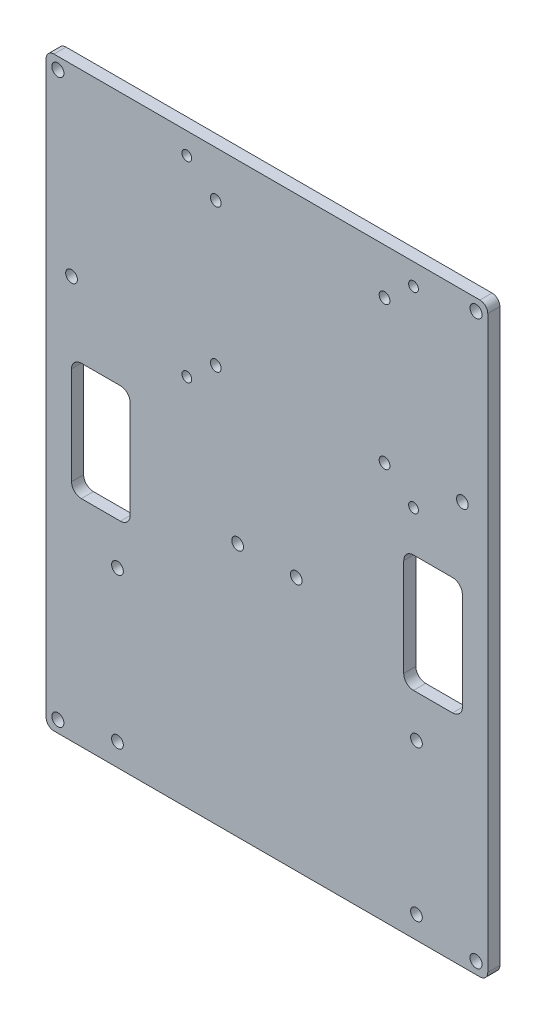
from build123d import *

# Parameters (mm, degrees)
SKETCH1_W           = 113
SKETCH1_H           = 150
BOSS_EXTRUDE1_DEPTH = 3.1
SKETCH9_R           = 1.55
CUT_EXTRUDE7_DEPTH  = 94.9513704
SKETCH10_R          = 1.25
CUT_EXTRUDE8_DEPTH  = 94.9513704
SKETCH12_R          = 1.5
CUT_EXTRUDE9_DEPTH  = 94.9513704
SKETCH13_R          = 1.5
CUT_EXTRUDE10_DEPTH = 94.9513704
SKETCH14_W          = 15
SKETCH14_H          = 30
CUT_EXTRUDE11_DEPTH = 94.9513704
SKETCH16_R          = 1.375
CUT_EXTRUDE12_DEPTH = 94.9513704
SKETCH18_R          = 1.5
CUT_EXTRUDE13_DEPTH = 94.9513704
FILLET1_R           = 2
FILLET2_R           = 2.5


with BuildPart() as part:
    # Sketch1 → Boss-Extrude1 (new body)
    with BuildSketch(Plane.XY):
        Rectangle(SKETCH1_W, SKETCH1_H)
    extrude(amount=BOSS_EXTRUDE1_DEPTH)

    # Sketch9 → Cut-Extrude7 (cut, through all)
    with BuildSketch(Plane.XY.offset(3.1)):
        with Locations((-53.5, 72)):
            Circle(SKETCH9_R)
        with Locations((53.5, 72)):
            Circle(SKETCH9_R)
        with Locations((53.5, -72)):
            Circle(SKETCH9_R)
        with Locations((-53.5, -72)):
            Circle(SKETCH9_R)
    extrude(amount=-CUT_EXTRUDE7_DEPTH, mode=Mode.SUBTRACT)

    # Sketch10 → Cut-Extrude8 (cut, through all)
    with BuildSketch(Plane.XY.offset(3.1)):
        with BuildLine():
            ThreePointArc((37.5, 21.75), (36.616116524, 21.383883476), (36.25, 20.5))
            Line((36.25, 20.5), (37.5, 20.5))
            Line((37.5, 20.5), (37.5, 21.75))
        make_face()
        with BuildLine():
            Line((37.5, 20.5), (36.25, 20.5))
            ThreePointArc((36.25, 20.5), (37.5, 19.25), (38.75, 20.5))
            ThreePointArc((38.75, 20.5), (38.383883476, 21.383883476), (37.5, 21.75))
            Line((37.5, 21.75), (37.5, 20.5))
        make_face()
        with Locations((-20.5, 69.5)):
            Circle(SKETCH10_R)
        with Locations((37.5, 69.5)):
            Circle(SKETCH10_R)
        with Locations((-20.5, 20.5)):
            Circle(SKETCH10_R)
    extrude(amount=-CUT_EXTRUDE8_DEPTH, mode=Mode.SUBTRACT)

    # Sketch12 → Cut-Extrude9 (cut, through all)
    with BuildSketch(Plane.XY.offset(3.1)):
        with Locations((-38.25, -30.75)):
            Circle(SKETCH12_R)
        with Locations((-38.25, -69.25)):
            Circle(SKETCH12_R)
        with Locations((38.25, -69.25)):
            Circle(SKETCH12_R)
        with Locations((38.25, -30.75)):
            Circle(SKETCH12_R)
    extrude(amount=-CUT_EXTRUDE9_DEPTH, mode=Mode.SUBTRACT)

    # Sketch13 → Cut-Extrude10 (cut, through all)
    with BuildSketch(Plane.XY.offset(3.1)):
        with Locations((-7.5, -10)):
            Circle(SKETCH13_R)
        with Locations((7.5, -10)):
            Circle(SKETCH13_R)
    extrude(amount=-CUT_EXTRUDE10_DEPTH, mode=Mode.SUBTRACT)

    # Sketch14 → Cut-Extrude11 (cut, through all)
    with BuildSketch(Plane.XY.offset(3.1)):
        with Locations((42.5, -5)):
            Rectangle(SKETCH14_W, SKETCH14_H)
        with Locations((-42.5, -5)):
            Rectangle(SKETCH14_W, SKETCH14_H)
    extrude(amount=-CUT_EXTRUDE11_DEPTH, mode=Mode.SUBTRACT)

    # Sketch16 → Cut-Extrude12 (cut, through all)
    with BuildSketch(Plane(origin=(0, 0, 0), x_dir=(-1, 0, 0), z_dir=(0, 0, -1))):
        with Locations((-30.09, 26.71)):
            Circle(SKETCH16_R)
        with Locations((13.09, 26.71)):
            Circle(SKETCH16_R)
        with Locations((13.09, 63.29)):
            Circle(SKETCH16_R)
        with Locations((-30.09, 63.29)):
            Circle(SKETCH16_R)
    extrude(amount=-CUT_EXTRUDE12_DEPTH, mode=Mode.SUBTRACT)

    # Sketch18 → Cut-Extrude13 (cut, through all)
    with BuildSketch(Plane.XY.offset(3.1)):
        with Locations((-50, 28)):
            Circle(SKETCH18_R)
        with Locations((50, 28)):
            Circle(SKETCH18_R)
    extrude(amount=-CUT_EXTRUDE13_DEPTH, mode=Mode.SUBTRACT)

    # Fillet1
    fillet1_edges = [part.edges().sort_by_distance(p)[0] for p in [
        (-56.5, 75, 1.55),
        (56.5, 75, 1.55),
        (56.5, -75, 1.55),
        (-56.5, -75, 1.55),
    ]]
    fillet(fillet1_edges, radius=FILLET1_R)

    # Fillet2
    fillet2_edges = [part.edges().sort_by_distance(p)[0] for p in [
        (-50, 10, 1.55),
        (-35, 10, 1.55),
        (-35, -20, 1.55),
        (-50, -20, 1.55),
        (50, 10, 1.55),
        (50, -20, 1.55),
        (35, -20, 1.55),
        (35, 10, 1.55),
    ]]
    fillet(fillet2_edges, radius=FILLET2_R)


solid = part.part
